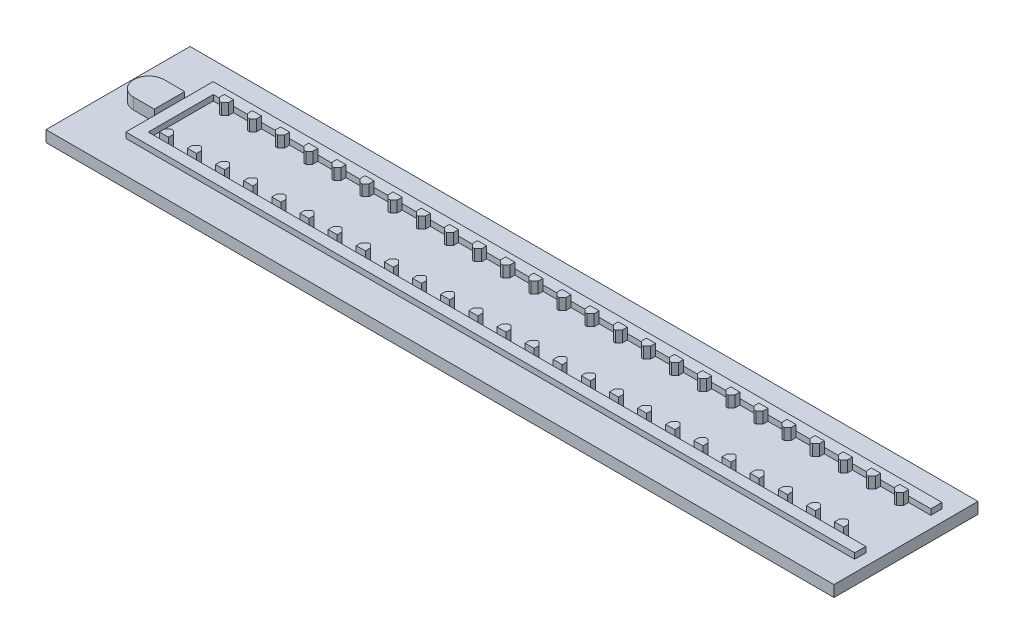
from build123d import *

# Parameters (mm, degrees)
BOSS_EXTRUDE6_DEPTH = 4
CUT_EXTRUDE1_DEPTH  = 2
BOSS_EXTRUDE7_DEPTH = 4


with BuildPart() as part:
    # Sketch1 → Boss-Extrude6 (new body)
    with BuildSketch(Plane(origin=(0, 0, 0), x_dir=(1, 0, 0), z_dir=(0, 1, 0))):
        with BuildLine():
            Line((-40.909030741, -5.399398075), (-40.909030741, -15.505395604))
            Line((-40.909030741, -15.505395604), (218.126084041, -15.505395604))
            Line((218.126084041, -15.505395604), (218.126084041, -11.561403071))
            Line((218.126084041, -11.561403071), (210.243243011, -11.561403071))
            Line((210.243243011, -11.561403071), (210.243243011, -9.792242237))
            Line((210.243243011, -9.792242237), (209.00278079, -8.551780016))
            Line((209.00278079, -8.551780016), (208.262673078, -8.551780016))
            Line((208.262673078, -8.551780016), (207.022210858, -9.792242237))
            Line((207.022210858, -9.792242237), (207.022210858, -11.561403071))
            Line((207.022210858, -11.561403071), (200.243243011, -11.561403071))
            Line((200.243243011, -11.561403071), (200.243243011, -9.792242237))
            Line((200.243243011, -9.792242237), (199.00278079, -8.551780016))
            Line((199.00278079, -8.551780016), (198.262673078, -8.551780016))
            Line((198.262673078, -8.551780016), (197.022210858, -9.792242237))
            Line((197.022210858, -9.792242237), (197.022210858, -11.561403071))
            Line((197.022210858, -11.561403071), (190.243243011, -11.561403071))
            Line((190.243243011, -11.561403071), (190.243243011, -9.792242237))
            Line((190.243243011, -9.792242237), (189.00278079, -8.551780016))
            Line((189.00278079, -8.551780016), (188.262673078, -8.551780016))
            Line((188.262673078, -8.551780016), (187.022210858, -9.792242237))
            Line((187.022210858, -9.792242237), (187.022210858, -11.561403071))
            Line((187.022210858, -11.561403071), (180.243243011, -11.561403071))
            Line((180.243243011, -11.561403071), (180.243243011, -9.792242237))
            Line((180.243243011, -9.792242237), (179.00278079, -8.551780016))
            Line((179.00278079, -8.551780016), (178.262673078, -8.551780016))
            Line((178.262673078, -8.551780016), (177.022210858, -9.792242237))
            Line((177.022210858, -9.792242237), (177.022210858, -11.561403071))
            Line((177.022210858, -11.561403071), (170.243243011, -11.561403071))
            Line((170.243243011, -11.561403071), (170.243243011, -9.792242237))
            Line((170.243243011, -9.792242237), (169.00278079, -8.551780016))
            Line((169.00278079, -8.551780016), (168.262673078, -8.551780016))
            Line((168.262673078, -8.551780016), (167.022210858, -9.792242237))
            Line((167.022210858, -9.792242237), (167.022210858, -11.561403071))
            Line((167.022210858, -11.561403071), (160.243243011, -11.561403071))
            Line((160.243243011, -11.561403071), (160.243243011, -9.792242237))
            Line((160.243243011, -9.792242237), (159.00278079, -8.551780016))
            Line((159.00278079, -8.551780016), (158.262673078, -8.551780016))
            Line((158.262673078, -8.551780016), (157.022210858, -9.792242237))
            Line((157.022210858, -9.792242237), (157.022210858, -11.561403071))
            Line((157.022210858, -11.561403071), (150.243243011, -11.561403071))
            Line((150.243243011, -11.561403071), (150.243243011, -9.792242237))
            Line((150.243243011, -9.792242237), (149.00278079, -8.551780016))
            Line((149.00278079, -8.551780016), (148.262673078, -8.551780016))
            Line((148.262673078, -8.551780016), (147.022210858, -9.792242237))
            Line((147.022210858, -9.792242237), (147.022210858, -11.561403071))
            Line((147.022210858, -11.561403071), (140.243243011, -11.561403071))
            Line((140.243243011, -11.561403071), (140.243243011, -9.792242237))
            Line((140.243243011, -9.792242237), (139.00278079, -8.551780016))
            Line((139.00278079, -8.551780016), (138.262673078, -8.551780016))
            Line((138.262673078, -8.551780016), (137.022210858, -9.792242237))
            Line((137.022210858, -9.792242237), (137.022210858, -11.561403071))
            Line((137.022210858, -11.561403071), (130.243243011, -11.561403071))
            Line((130.243243011, -11.561403071), (130.243243011, -9.792242237))
            Line((130.243243011, -9.792242237), (129.00278079, -8.551780016))
            Line((129.00278079, -8.551780016), (128.262673078, -8.551780016))
            Line((128.262673078, -8.551780016), (127.022210858, -9.792242237))
            Line((127.022210858, -9.792242237), (127.022210858, -11.561403071))
            Line((127.022210858, -11.561403071), (120.243243011, -11.561403071))
            Line((120.243243011, -11.561403071), (120.243243011, -9.792242237))
            Line((120.243243011, -9.792242237), (119.00278079, -8.551780016))
            Line((119.00278079, -8.551780016), (118.262673078, -8.551780016))
            Line((118.262673078, -8.551780016), (117.022210858, -9.792242237))
            Line((117.022210858, -9.792242237), (117.022210858, -11.561403071))
            Line((117.022210858, -11.561403071), (110.243243011, -11.561403071))
            Line((110.243243011, -11.561403071), (110.243243011, -9.792242237))
            Line((110.243243011, -9.792242237), (109.00278079, -8.551780016))
            Line((109.00278079, -8.551780016), (108.262673078, -8.551780016))
            Line((108.262673078, -8.551780016), (107.022210858, -9.792242237))
            Line((107.022210858, -9.792242237), (107.022210858, -11.561403071))
            Line((107.022210858, -11.561403071), (100.243243011, -11.561403071))
            Line((100.243243011, -11.561403071), (100.243243011, -9.792242237))
            Line((100.243243011, -9.792242237), (99.00278079, -8.551780016))
            Line((99.00278079, -8.551780016), (98.262673078, -8.551780016))
            Line((98.262673078, -8.551780016), (97.022210858, -9.792242237))
            Line((97.022210858, -9.792242237), (97.022210858, -11.561403071))
            Line((97.022210858, -11.561403071), (90.243243011, -11.561403071))
            Line((90.243243011, -11.561403071), (90.243243011, -9.792242237))
            Line((90.243243011, -9.792242237), (89.00278079, -8.551780016))
            Line((89.00278079, -8.551780016), (88.262673078, -8.551780016))
            Line((88.262673078, -8.551780016), (87.022210858, -9.792242237))
            Line((87.022210858, -9.792242237), (87.022210858, -11.561403071))
            Line((87.022210858, -11.561403071), (80.243243011, -11.561403071))
            Line((80.243243011, -11.561403071), (80.243243011, -9.792242237))
            Line((80.243243011, -9.792242237), (79.00278079, -8.551780016))
            Line((79.00278079, -8.551780016), (78.262673078, -8.551780016))
            Line((78.262673078, -8.551780016), (77.022210858, -9.792242237))
            Line((77.022210858, -9.792242237), (77.022210858, -11.561403071))
            Line((77.022210858, -11.561403071), (70.243243011, -11.561403071))
            Line((70.243243011, -11.561403071), (70.243243011, -9.792242237))
            Line((70.243243011, -9.792242237), (69.00278079, -8.551780016))
            Line((69.00278079, -8.551780016), (68.262673078, -8.551780016))
            Line((68.262673078, -8.551780016), (67.022210858, -9.792242237))
            Line((67.022210858, -9.792242237), (67.022210858, -11.561403071))
            Line((67.022210858, -11.561403071), (60.243243011, -11.561403071))
            Line((60.243243011, -11.561403071), (60.243243011, -9.792242237))
            Line((60.243243011, -9.792242237), (59.00278079, -8.551780016))
            Line((59.00278079, -8.551780016), (58.262673078, -8.551780016))
            Line((58.262673078, -8.551780016), (57.022210858, -9.792242237))
            Line((57.022210858, -9.792242237), (57.022210858, -11.561403071))
            Line((57.022210858, -11.561403071), (50.243243011, -11.561403071))
            Line((50.243243011, -11.561403071), (50.243243011, -9.792242237))
            Line((50.243243011, -9.792242237), (49.00278079, -8.551780016))
            Line((49.00278079, -8.551780016), (48.262673078, -8.551780016))
            Line((48.262673078, -8.551780016), (47.022210858, -9.792242237))
            Line((47.022210858, -9.792242237), (47.022210858, -11.561403071))
            Line((47.022210858, -11.561403071), (40.243243011, -11.561403071))
            Line((40.243243011, -11.561403071), (40.243243011, -9.792242237))
            Line((40.243243011, -9.792242237), (39.00278079, -8.551780016))
            Line((39.00278079, -8.551780016), (38.262673078, -8.551780016))
            Line((38.262673078, -8.551780016), (37.022210858, -9.792242237))
            Line((37.022210858, -9.792242237), (37.022210858, -11.561403071))
            Line((37.022210858, -11.561403071), (30.243243011, -11.561403071))
            Line((30.243243011, -11.561403071), (30.243243011, -9.792242237))
            Line((30.243243011, -9.792242237), (29.00278079, -8.551780016))
            Line((29.00278079, -8.551780016), (28.262673078, -8.551780016))
            Line((28.262673078, -8.551780016), (27.022210858, -9.792242237))
            Line((27.022210858, -9.792242237), (27.022210858, -11.561403071))
            Line((27.022210858, -11.561403071), (20.243243011, -11.561403071))
            Line((20.243243011, -11.561403071), (20.243243011, -9.792242237))
            Line((20.243243011, -9.792242237), (19.00278079, -8.551780016))
            Line((19.00278079, -8.551780016), (18.262673078, -8.551780016))
            Line((18.262673078, -8.551780016), (17.022210858, -9.792242237))
            Line((17.022210858, -9.792242237), (17.022210858, -11.561403071))
            Line((17.022210858, -11.561403071), (10.243243011, -11.561403071))
            Line((10.243243011, -11.561403071), (10.243243011, -9.792242237))
            Line((10.243243011, -9.792242237), (9.00278079, -8.551780016))
            Line((9.00278079, -8.551780016), (8.262673078, -8.551780016))
            Line((8.262673078, -8.551780016), (7.022210858, -9.792242237))
            Line((7.022210858, -9.792242237), (7.022210858, -11.561403071))
            Line((7.022210858, -11.561403071), (0.243243011, -11.561403071))
            Line((0.243243011, -11.561403071), (0.243243011, -9.792242237))
            Line((0.243243011, -9.792242237), (-0.99721921, -8.551780016))
            Line((-0.99721921, -8.551780016), (-1.737326922, -8.551780016))
            Line((-1.737326922, -8.551780016), (-2.977789142, -9.792242237))
            Line((-2.977789142, -9.792242237), (-2.977789142, -11.561403071))
            Line((-2.977789142, -11.561403071), (-9.756756989, -11.561403071))
            Line((-9.756756989, -11.561403071), (-9.756756989, -9.792242237))
            Line((-9.756756989, -9.792242237), (-10.99721921, -8.551780016))
            Line((-10.99721921, -8.551780016), (-11.737326922, -8.551780016))
            Line((-11.737326922, -8.551780016), (-12.977789142, -9.792242237))
            Line((-12.977789142, -9.792242237), (-12.977789142, -11.561403071))
            Line((-12.977789142, -11.561403071), (-19.756756989, -11.561403071))
            Line((-19.756756989, -11.561403071), (-19.756756989, -9.792242237))
            Line((-19.756756989, -9.792242237), (-20.99721921, -8.551780016))
            Line((-20.99721921, -8.551780016), (-21.737326922, -8.551780016))
            Line((-21.737326922, -8.551780016), (-22.977789142, -9.792242237))
            Line((-22.977789142, -9.792242237), (-22.977789142, -11.561403071))
            Line((-22.977789142, -11.561403071), (-29.756756989, -11.561403071))
            Line((-29.756756989, -11.561403071), (-29.756756989, -9.792242237))
            Line((-29.756756989, -9.792242237), (-30.99721921, -8.551780016))
            Line((-30.99721921, -8.551780016), (-31.737326922, -8.551780016))
            Line((-31.737326922, -8.551780016), (-32.977789142, -9.792242237))
            Line((-32.977789142, -9.792242237), (-32.977789142, -11.561403071))
            Line((-32.977789142, -11.561403071), (-36.909030741, -11.561403071))
            Line((-36.909030741, -11.561403071), (-36.909030741, 11.561403071))
            Line((-36.909030741, 11.561403071), (-32.977789142, 11.561403071))
            Line((-32.977789142, 11.561403071), (-32.977789142, 9.792242237))
            Line((-32.977789142, 9.792242237), (-31.737326922, 8.551780016))
            Line((-31.737326922, 8.551780016), (-30.99721921, 8.551780016))
            Line((-30.99721921, 8.551780016), (-29.756756989, 9.792242237))
            Line((-29.756756989, 9.792242237), (-29.756756989, 11.561403071))
            Line((-29.756756989, 11.561403071), (-22.977789142, 11.561403071))
            Line((-22.977789142, 11.561403071), (-22.977789142, 9.792242237))
            Line((-22.977789142, 9.792242237), (-21.737326922, 8.551780016))
            Line((-21.737326922, 8.551780016), (-20.99721921, 8.551780016))
            Line((-20.99721921, 8.551780016), (-19.756756989, 9.792242237))
            Line((-19.756756989, 9.792242237), (-19.756756989, 11.561403071))
            Line((-19.756756989, 11.561403071), (-12.977789142, 11.561403071))
            Line((-12.977789142, 11.561403071), (-12.977789142, 9.792242237))
            Line((-12.977789142, 9.792242237), (-11.737326922, 8.551780016))
            Line((-11.737326922, 8.551780016), (-10.99721921, 8.551780016))
            Line((-10.99721921, 8.551780016), (-9.756756989, 9.792242237))
            Line((-9.756756989, 9.792242237), (-9.756756989, 11.561403071))
            Line((-9.756756989, 11.561403071), (-2.977789142, 11.561403071))
            Line((-2.977789142, 11.561403071), (-2.977789142, 9.792242237))
            Line((-2.977789142, 9.792242237), (-1.737326922, 8.551780016))
            Line((-1.737326922, 8.551780016), (-0.99721921, 8.551780016))
            Line((-0.99721921, 8.551780016), (0.243243011, 9.792242237))
            Line((0.243243011, 9.792242237), (0.243243011, 11.561403071))
            Line((0.243243011, 11.561403071), (7.022210858, 11.561403071))
            Line((7.022210858, 11.561403071), (7.022210858, 9.792242237))
            Line((7.022210858, 9.792242237), (8.262673078, 8.551780016))
            Line((8.262673078, 8.551780016), (9.00278079, 8.551780016))
            Line((9.00278079, 8.551780016), (10.243243011, 9.792242237))
            Line((10.243243011, 9.792242237), (10.243243011, 11.561403071))
            Line((10.243243011, 11.561403071), (17.022210858, 11.561403071))
            Line((17.022210858, 11.561403071), (17.022210858, 9.792242237))
            Line((17.022210858, 9.792242237), (18.262673078, 8.551780016))
            Line((18.262673078, 8.551780016), (19.00278079, 8.551780016))
            Line((19.00278079, 8.551780016), (20.243243011, 9.792242237))
            Line((20.243243011, 9.792242237), (20.243243011, 11.561403071))
            Line((20.243243011, 11.561403071), (27.022210858, 11.561403071))
            Line((27.022210858, 11.561403071), (27.022210858, 9.792242237))
            Line((27.022210858, 9.792242237), (28.262673078, 8.551780016))
            Line((28.262673078, 8.551780016), (29.00278079, 8.551780016))
            Line((29.00278079, 8.551780016), (30.243243011, 9.792242237))
            Line((30.243243011, 9.792242237), (30.243243011, 11.561403071))
            Line((30.243243011, 11.561403071), (37.022210858, 11.561403071))
            Line((37.022210858, 11.561403071), (37.022210858, 9.792242237))
            Line((37.022210858, 9.792242237), (38.262673078, 8.551780016))
            Line((38.262673078, 8.551780016), (39.00278079, 8.551780016))
            Line((39.00278079, 8.551780016), (40.243243011, 9.792242237))
            Line((40.243243011, 9.792242237), (40.243243011, 11.561403071))
            Line((40.243243011, 11.561403071), (47.022210858, 11.561403071))
            Line((47.022210858, 11.561403071), (47.022210858, 9.792242237))
            Line((47.022210858, 9.792242237), (48.262673078, 8.551780016))
            Line((48.262673078, 8.551780016), (49.00278079, 8.551780016))
            Line((49.00278079, 8.551780016), (50.243243011, 9.792242237))
            Line((50.243243011, 9.792242237), (50.243243011, 11.561403071))
            Line((50.243243011, 11.561403071), (57.022210858, 11.561403071))
            Line((57.022210858, 11.561403071), (57.022210858, 9.792242237))
            Line((57.022210858, 9.792242237), (58.262673078, 8.551780016))
            Line((58.262673078, 8.551780016), (59.00278079, 8.551780016))
            Line((59.00278079, 8.551780016), (60.243243011, 9.792242237))
            Line((60.243243011, 9.792242237), (60.243243011, 11.561403071))
            Line((60.243243011, 11.561403071), (67.022210858, 11.561403071))
            Line((67.022210858, 11.561403071), (67.022210858, 9.792242237))
            Line((67.022210858, 9.792242237), (68.262673078, 8.551780016))
            Line((68.262673078, 8.551780016), (69.00278079, 8.551780016))
            Line((69.00278079, 8.551780016), (70.243243011, 9.792242237))
            Line((70.243243011, 9.792242237), (70.243243011, 11.561403071))
            Line((70.243243011, 11.561403071), (77.022210858, 11.561403071))
            Line((77.022210858, 11.561403071), (77.022210858, 9.792242237))
            Line((77.022210858, 9.792242237), (78.262673078, 8.551780016))
            Line((78.262673078, 8.551780016), (79.00278079, 8.551780016))
            Line((79.00278079, 8.551780016), (80.243243011, 9.792242237))
            Line((80.243243011, 9.792242237), (80.243243011, 11.561403071))
            Line((80.243243011, 11.561403071), (87.022210858, 11.561403071))
            Line((87.022210858, 11.561403071), (87.022210858, 9.792242237))
            Line((87.022210858, 9.792242237), (88.262673078, 8.551780016))
            Line((88.262673078, 8.551780016), (89.00278079, 8.551780016))
            Line((89.00278079, 8.551780016), (90.243243011, 9.792242237))
            Line((90.243243011, 9.792242237), (90.243243011, 11.561403071))
            Line((90.243243011, 11.561403071), (97.022210858, 11.561403071))
            Line((97.022210858, 11.561403071), (97.022210858, 9.792242237))
            Line((97.022210858, 9.792242237), (98.262673078, 8.551780016))
            Line((98.262673078, 8.551780016), (99.00278079, 8.551780016))
            Line((99.00278079, 8.551780016), (100.243243011, 9.792242237))
            Line((100.243243011, 9.792242237), (100.243243011, 11.561403071))
            Line((100.243243011, 11.561403071), (107.022210858, 11.561403071))
            Line((107.022210858, 11.561403071), (107.022210858, 9.792242237))
            Line((107.022210858, 9.792242237), (108.262673078, 8.551780016))
            Line((108.262673078, 8.551780016), (109.00278079, 8.551780016))
            Line((109.00278079, 8.551780016), (110.243243011, 9.792242237))
            Line((110.243243011, 9.792242237), (110.243243011, 11.561403071))
            Line((110.243243011, 11.561403071), (117.022210858, 11.561403071))
            Line((117.022210858, 11.561403071), (117.022210858, 9.792242237))
            Line((117.022210858, 9.792242237), (118.262673078, 8.551780016))
            Line((118.262673078, 8.551780016), (119.00278079, 8.551780016))
            Line((119.00278079, 8.551780016), (120.243243011, 9.792242237))
            Line((120.243243011, 9.792242237), (120.243243011, 11.561403071))
            Line((120.243243011, 11.561403071), (127.022210858, 11.561403071))
            Line((127.022210858, 11.561403071), (127.022210858, 9.792242237))
            Line((127.022210858, 9.792242237), (128.262673078, 8.551780016))
            Line((128.262673078, 8.551780016), (129.00278079, 8.551780016))
            Line((129.00278079, 8.551780016), (130.243243011, 9.792242237))
            Line((130.243243011, 9.792242237), (130.243243011, 11.561403071))
            Line((130.243243011, 11.561403071), (137.022210858, 11.561403071))
            Line((137.022210858, 11.561403071), (137.022210858, 9.792242237))
            Line((137.022210858, 9.792242237), (138.262673078, 8.551780016))
            Line((138.262673078, 8.551780016), (139.00278079, 8.551780016))
            Line((139.00278079, 8.551780016), (140.243243011, 9.792242237))
            Line((140.243243011, 9.792242237), (140.243243011, 11.561403071))
            Line((140.243243011, 11.561403071), (147.022210858, 11.561403071))
            Line((147.022210858, 11.561403071), (147.022210858, 9.792242237))
            Line((147.022210858, 9.792242237), (148.262673078, 8.551780016))
            Line((148.262673078, 8.551780016), (149.00278079, 8.551780016))
            Line((149.00278079, 8.551780016), (150.243243011, 9.792242237))
            Line((150.243243011, 9.792242237), (150.243243011, 11.561403071))
            Line((150.243243011, 11.561403071), (157.022210858, 11.561403071))
            Line((157.022210858, 11.561403071), (157.022210858, 9.792242237))
            Line((157.022210858, 9.792242237), (158.262673078, 8.551780016))
            Line((158.262673078, 8.551780016), (159.00278079, 8.551780016))
            Line((159.00278079, 8.551780016), (160.243243011, 9.792242237))
            Line((160.243243011, 9.792242237), (160.243243011, 11.561403071))
            Line((160.243243011, 11.561403071), (167.022210858, 11.561403071))
            Line((167.022210858, 11.561403071), (167.022210858, 9.792242237))
            Line((167.022210858, 9.792242237), (168.262673078, 8.551780016))
            Line((168.262673078, 8.551780016), (169.00278079, 8.551780016))
            Line((169.00278079, 8.551780016), (170.243243011, 9.792242237))
            Line((170.243243011, 9.792242237), (170.243243011, 11.561403071))
            Line((170.243243011, 11.561403071), (177.022210858, 11.561403071))
            Line((177.022210858, 11.561403071), (177.022210858, 9.792242237))
            Line((177.022210858, 9.792242237), (178.262673078, 8.551780016))
            Line((178.262673078, 8.551780016), (179.00278079, 8.551780016))
            Line((179.00278079, 8.551780016), (180.243243011, 9.792242237))
            Line((180.243243011, 9.792242237), (180.243243011, 11.561403071))
            Line((180.243243011, 11.561403071), (187.022210858, 11.561403071))
            Line((187.022210858, 11.561403071), (187.022210858, 9.792242237))
            Line((187.022210858, 9.792242237), (188.262673078, 8.551780016))
            Line((188.262673078, 8.551780016), (189.00278079, 8.551780016))
            Line((189.00278079, 8.551780016), (190.243243011, 9.792242237))
            Line((190.243243011, 9.792242237), (190.243243011, 11.561403071))
            Line((190.243243011, 11.561403071), (197.022210858, 11.561403071))
            Line((197.022210858, 11.561403071), (197.022210858, 9.792242237))
            Line((197.022210858, 9.792242237), (198.262673078, 8.551780016))
            Line((198.262673078, 8.551780016), (199.00278079, 8.551780016))
            Line((199.00278079, 8.551780016), (200.243243011, 9.792242237))
            Line((200.243243011, 9.792242237), (200.243243011, 11.561403071))
            Line((200.243243011, 11.561403071), (207.022210858, 11.561403071))
            Line((207.022210858, 11.561403071), (207.022210858, 9.792242237))
            Line((207.022210858, 9.792242237), (208.262673078, 8.551780016))
            Line((208.262673078, 8.551780016), (209.00278079, 8.551780016))
            Line((209.00278079, 8.551780016), (210.243243011, 9.792242237))
            Line((210.243243011, 9.792242237), (210.243243011, 11.561403071))
            Line((210.243243011, 11.561403071), (218.126084041, 11.561403071))
            Line((218.126084041, 11.561403071), (218.126084041, 15.505395604))
            Line((218.126084041, 15.505395604), (-40.909030741, 15.505395604))
            Line((-40.909030741, 15.505395604), (-40.909030741, 5.399398075))
            Line((-40.909030741, 5.399398075), (-48.250990074, 5.399398075))
            ThreePointArc((-48.250990074, 5.399398075), (-53.650388149, 0), (-48.250990074, -5.399398075))
            Line((-48.250990074, -5.399398075), (-40.909030741, -5.399398075))
        make_face()
    extrude(amount=BOSS_EXTRUDE6_DEPTH)

    # Sketch2 → Cut-Extrude1 (cut)
    with BuildSketch(Plane(origin=(0, 4, 0), x_dir=(1, 0, 0), z_dir=(0, 1, 0))):
        Polygon((-40.909030741, 15.505395604), (218.126084041, 15.505395604), (218.126084041, 11.561403071), (-36.909030741, 11.561403071), (-36.909030741, -11.561403071), (218.126084041, -11.561403071), (218.126084041, -15.505395604), (-40.909030741, -15.505395604), align=None)
    extrude(amount=-CUT_EXTRUDE1_DEPTH, mode=Mode.SUBTRACT)

    # Sketch3 → Boss-Extrude7 (add)
    with BuildSketch(Plane(origin=(-29.756756989, 0, 11.561403071), x_dir=(1, 0, 0), z_dir=(0, -1, 0))):
        Polygon((-28.087175159, -35.785761558), (251.982242566, -35.785761558), (251.982242566, 15.399338923), (-28.087175159, 15.399338923), (-28.087175159, -34.176167204), align=None)
    extrude(amount=BOSS_EXTRUDE7_DEPTH)


solid = part.part
